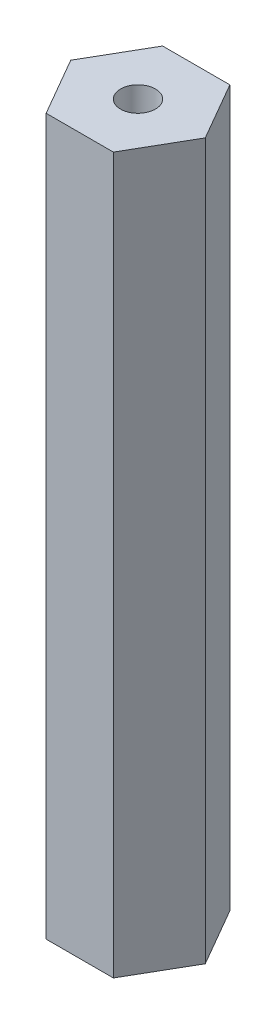
from build123d import *

# Parameters (mm, degrees)
EXTRUDE_1_DEPTH     = 30.7
SKETCH_2_R          = 0.75
CUT_EXTRUDE_1_DEPTH = 31.936601839


with BuildPart() as part:
    # Эскиз1 → Бобышка-Вытянуть1 (new body)
    with BuildSketch(Plane(origin=(0, 0, 0), x_dir=(1, 0, 0), z_dir=(0, 1, 0))):
        Polygon((2.886751346, 0), (1.443375673, 2.5), (-1.443375673, 2.5), (-2.886751346, 0), (-1.443375673, -2.5), (1.443375673, -2.5), align=None)
    extrude(amount=EXTRUDE_1_DEPTH)

    # Эскиз2 → Вырез-Вытянуть1 (cut, through all)
    with BuildSketch(Plane(origin=(0, 30.7, 0), x_dir=(1, 0, 0), z_dir=(0, 1, 0))):
        with Locations(Location((0, 0, 0), (0, 0, 270))):
            Circle(SKETCH_2_R)
    extrude(amount=-CUT_EXTRUDE_1_DEPTH, mode=Mode.SUBTRACT)


solid = part.part
